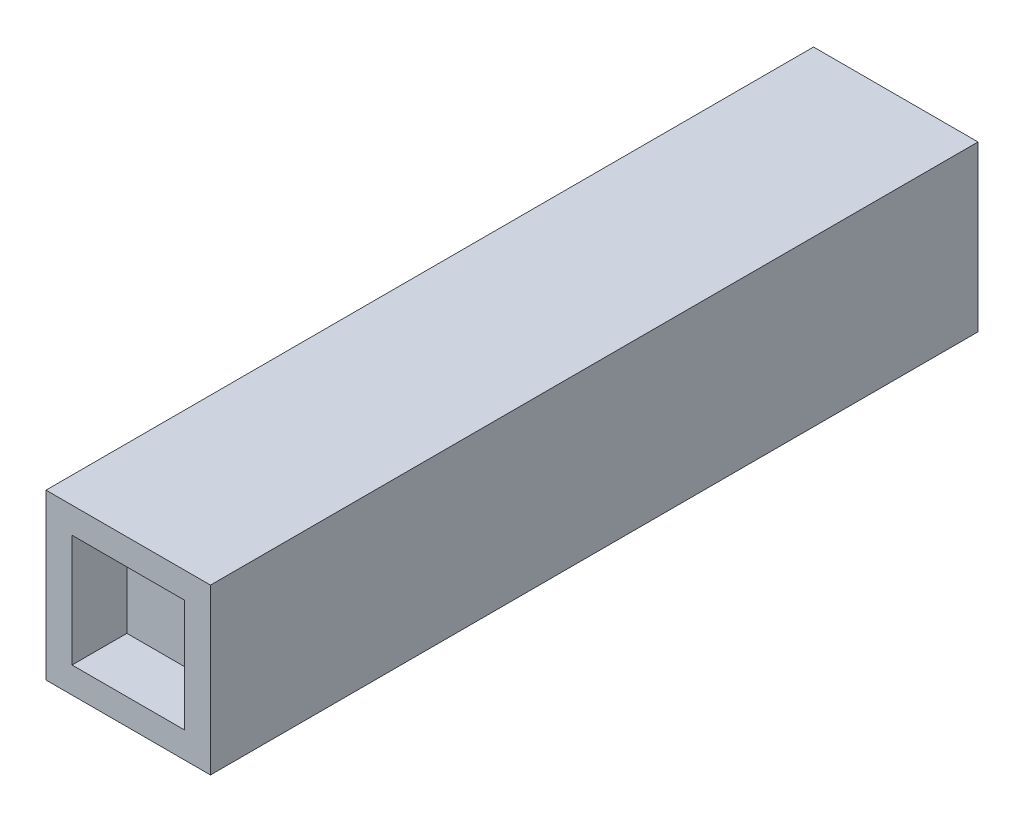
from build123d import *

# Parameters (mm, degrees)
SKETCH1_W           = 30
SKETCH1_H           = 30
BOSS_EXTRUDE1_DEPTH = 140
SKETCH2_W           = 20
SKETCH2_H           = 20
BOSS_EXTRUDE2_DEPTH = 5
SKETCH3_W           = 20.5
SKETCH3_H           = 20.5
CUT_EXTRUDE1_DEPTH  = 10


with BuildPart() as part:
    # Sketch1 → Boss-Extrude1 (new body)
    with BuildSketch(Plane.XY):
        Rectangle(SKETCH1_W, SKETCH1_H)
    extrude(amount=BOSS_EXTRUDE1_DEPTH)

    # Sketch2 → Boss-Extrude2 (add)
    with BuildSketch(Plane.XY):
        Rectangle(SKETCH2_W, SKETCH2_H)
    extrude(amount=-BOSS_EXTRUDE2_DEPTH)

    # Sketch3 → Cut-Extrude1 (cut)
    with BuildSketch(Plane.XY.offset(140)):
        Rectangle(SKETCH3_W, SKETCH3_H)
    extrude(amount=-CUT_EXTRUDE1_DEPTH, mode=Mode.SUBTRACT)


solid = part.part
